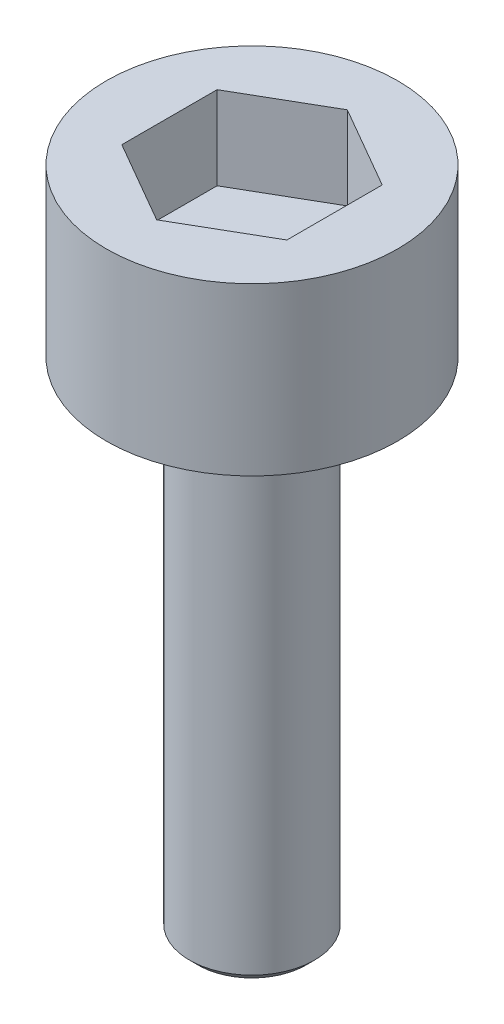
from build123d import *

# Parameters (mm, degrees)
CROQUIS1_R              = 3.5
SALIENTE_EXTRUIR1_DEPTH = 4
CROQUIS2_R              = 1.5
SALIENTE_EXTRUIR2_DEPTH = 12
CHAFL_N1_SIZE           = 0.2
CORTAR_EXTRUIR1_DEPTH   = 2


with BuildPart() as part:
    # Croquis1 → Saliente-Extruir1 (new body)
    with BuildSketch(Plane(origin=(0, 0, 0), x_dir=(1, 0, 0), z_dir=(0, 1, 0))):
        with Locations(Location((0, 0, 0), (0, 0, 270))):
            Circle(CROQUIS1_R)
    extrude(amount=SALIENTE_EXTRUIR1_DEPTH)

    # Croquis2 → Saliente-Extruir2 (add)
    with BuildSketch(Plane.XZ):
        with Locations(Location((0, 0, 0), (0, 0, 270))):
            Circle(CROQUIS2_R)
    extrude(amount=SALIENTE_EXTRUIR2_DEPTH)

    # Chaflán1
    chafl_n1_edges = [part.edges().sort_by_distance(p)[0] for p in [
        (0, -12, 1.5),
    ]]
    chamfer(chafl_n1_edges, length=CHAFL_N1_SIZE)

    # Croquis3 → Cortar-Extruir1 (cut)
    with BuildSketch(Plane(origin=(0, 4, 0), x_dir=(1, 0, 0), z_dir=(0, 1, 0))):
        Polygon((0, 2.289686923), (-1.982927042, 1.144843462), (-1.982927042, -1.144843462), (0, -2.289686923), (1.982927042, -1.144843462), (1.982927042, 1.144843462), align=None)
    extrude(amount=-CORTAR_EXTRUIR1_DEPTH, mode=Mode.SUBTRACT)


solid = part.part
